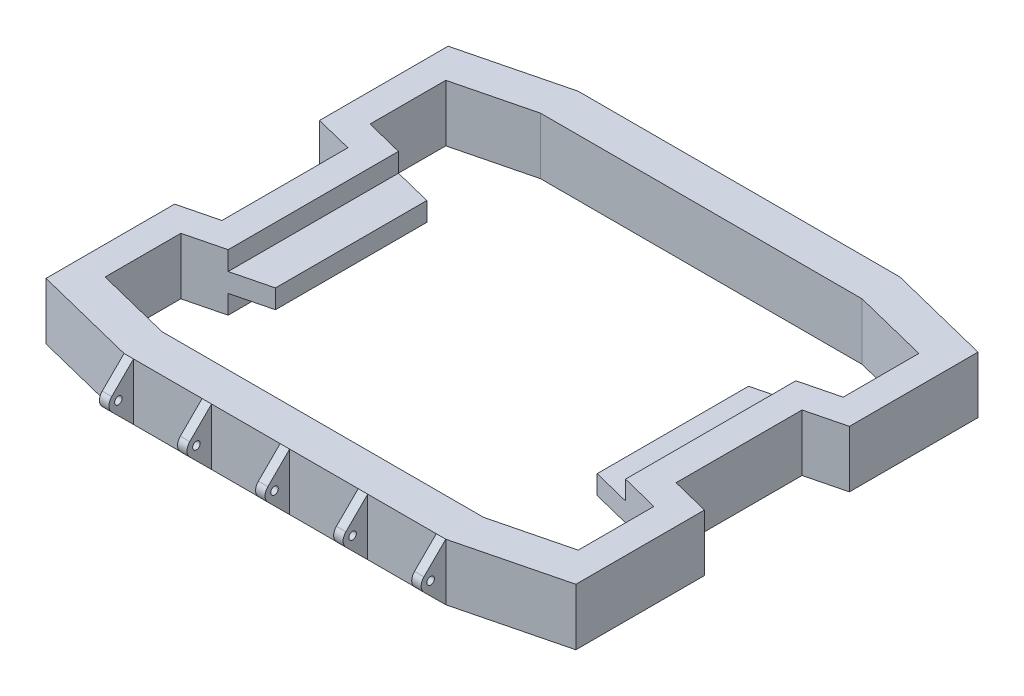
from build123d import *

# Parameters (mm, degrees)
BOSS_EXTRUDE1_DEPTH = 38.1
SKETCH2_R           = 2.54
BOSS_EXTRUDE2_DEPTH = 6.35
LPATTERN1_COUNT     = 5
LPATTERN1_PITCH     = 52.3875
BOSS_EXTRUDE3_DEPTH = 25.4
CUT_EXTRUDE1_DEPTH  = 12.7


with BuildPart() as part:
    # Sketch1 → Boss-Extrude1 (new body)
    with BuildSketch(Plane(origin=(0, 0, 0), x_dir=(1, 0, 0), z_dir=(0, 1, 0))):
        Polygon((-69.85, 261.9375), (-69.85, 175.626209458), (-44.45, 169.276209458), (-44.45, 84.723790542), (-69.85, 78.373790542), (-69.85, -7.9375), (0, -25.4), (215.9, -25.4), (285.75, -7.9375), (285.75, 78.373790542), (260.35, 84.723790542), (260.35, 169.276209458), (285.75, 175.626209458), (285.75, 261.9375), (215.9, 279.4), (0, 279.4), align=None)
        Polygon((-25.4, 69.85), (-25.4, 184.15), (-50.8, 190.5), (-50.8, 241.3), (0, 254), (215.9, 254), (266.7, 241.3), (266.7, 190.5), (241.3, 184.15), (241.3, 69.85), (266.7, 63.5), (266.7, 12.7), (215.9, 0), (0, 0), (-50.8, 12.7), (-50.8, 63.5), align=None, mode=Mode.SUBTRACT)
    extrude(amount=BOSS_EXTRUDE1_DEPTH)

    # Sketch2 → Boss-Extrude2 (add)
    with BuildSketch(Plane(origin=(0, 0, 0), x_dir=(0, 0, -1), z_dir=(1, 0, 0))):
        with BuildLine():
            Line((-40.036226007, 23.553987204), (-25.4, 38.1))
            Line((-25.4, 38.1), (-25.4, 0))
            Line((-25.4, 0), (-40.036226007, 14.546012796))
            ThreePointArc((-40.036226007, 14.546012796), (-41.91, 19.05), (-40.036226007, 23.553987204))
        make_face()
        with Locations((-35.56, 19.05)):
            Circle(SKETCH2_R, mode=Mode.SUBTRACT)
    boss_extrude2 = extrude(amount=BOSS_EXTRUDE2_DEPTH)

    # LPattern1: Boss-Extrude2 ×5
    with Locations(*[(i * LPATTERN1_PITCH, 0, 0) for i in range(1, LPATTERN1_COUNT)]):
        add(boss_extrude2)

    # Sketch1<3> → Boss-Extrude3 (add)
    with BuildSketch(Plane(origin=(0, 0, 0), x_dir=(1, 0, 0), z_dir=(0, 1, 0))):
        Polygon((0, 76.2), (0, 177.8), (-25.4, 184.15), (-25.4, 69.85), align=None)
        Polygon((241.3, 69.85), (241.3, 184.15), (215.9, 177.8), (215.9, 76.2), align=None)
    extrude(amount=BOSS_EXTRUDE3_DEPTH)

    # Sketch1<4> → Cut-Extrude1 (cut)
    with BuildSketch(Plane(origin=(0, 0, 0), x_dir=(1, 0, 0), z_dir=(0, 1, 0))):
        Polygon((0, 76.2), (0, 177.8), (-25.4, 184.15), (-25.4, 69.85), align=None)
        Polygon((241.3, 69.85), (241.3, 184.15), (215.9, 177.8), (215.9, 76.2), align=None)
    extrude(amount=CUT_EXTRUDE1_DEPTH, mode=Mode.SUBTRACT)


solid = part.part
